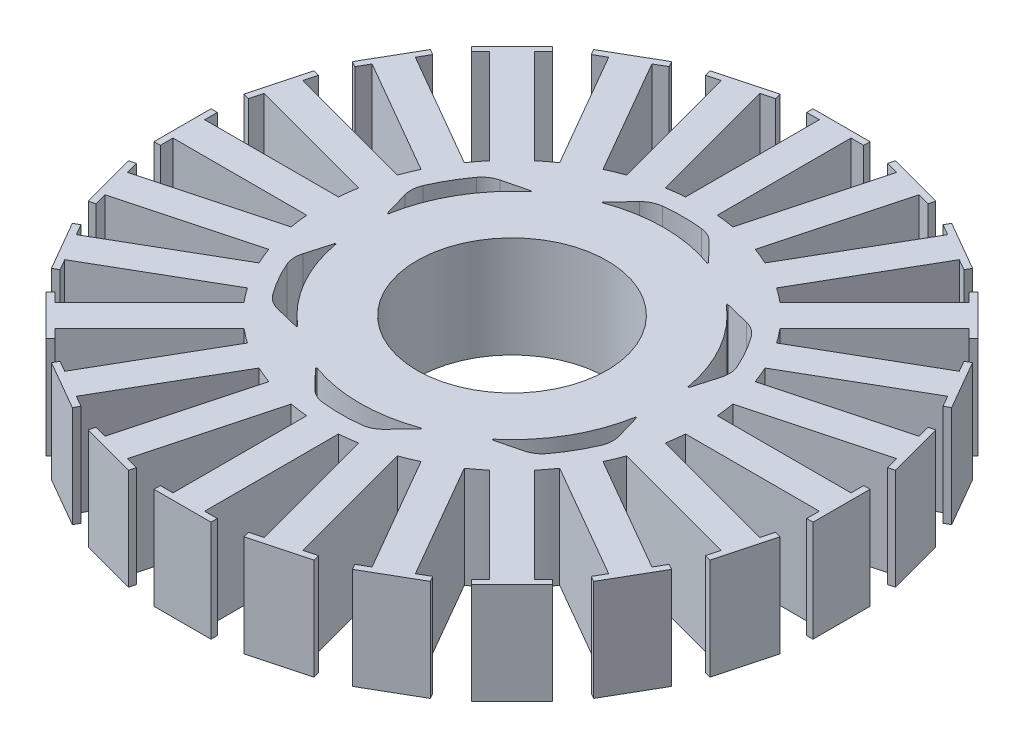
from build123d import *

# Parameters (mm, degrees)
SKETCH3_R           = 7.5
BOSS_EXTRUDE1_DEPTH = 8
CUT_EXTRUDE1_DEPTH  = 8


with BuildPart() as part:
    # Sketch3 → Boss-Extrude1 (new body)
    with BuildSketch(Plane(origin=(0, 0, 0), x_dir=(1, 0, 0), z_dir=(0, 1, 0))):
        with BuildLine():
            Line((-1.25, 25.5), (-1.25, 14.947825929))
            ThreePointArc((-1.25, 14.947825929), (-1.957892883, 14.871672921), (-2.66137475, 14.762014918))
            Line((-2.66137475, 14.762014918), (-5.392478367, 24.954632377))
            Line((-5.392478367, 24.954632377), (-4.426552541, 25.213451422))
            Line((-4.426552541, 25.213451422), (-4.555962064, 25.696414335))
            Line((-4.555962064, 25.696414335), (-8.902628282, 24.531728632))
            Line((-8.902628282, 24.531728632), (-8.773218759, 24.048765719))
            Line((-8.773218759, 24.048765719), (-7.807292933, 24.307584764))
            Line((-7.807292933, 24.307584764), (-5.076189316, 14.114967305))
            ThreePointArc((-5.076189316, 14.114967305), (-5.740251485, 13.858192988), (-6.39138121, 13.570196986))
            Line((-6.39138121, 13.570196986), (-11.667468245, 22.708647797))
            Line((-11.667468245, 22.708647797), (-10.801442841, 23.208647797))
            Line((-10.801442841, 23.208647797), (-11.051442841, 23.641660498))
            Line((-11.051442841, 23.641660498), (-14.948557159, 21.391660498))
            Line((-14.948557159, 21.391660498), (-14.698557159, 20.958647797))
            Line((-14.698557159, 20.958647797), (-13.832531755, 21.458647797))
            Line((-13.832531755, 21.458647797), (-8.556444719, 12.320196986))
            ThreePointArc((-8.556444719, 12.320196986), (-9.131421435, 11.900300104), (-9.685825602, 11.453592555))
            Line((-9.685825602, 11.453592555), (-17.147339444, 18.915106397))
            Line((-17.147339444, 18.915106397), (-16.440232663, 19.622213178))
            Line((-16.440232663, 19.622213178), (-16.793786053, 19.975766569))
            Line((-16.793786053, 19.975766569), (-19.975766569, 16.793786053))
            Line((-19.975766569, 16.793786053), (-19.622213178, 16.440232663))
            Line((-19.622213178, 16.440232663), (-18.915106397, 17.147339444))
            Line((-18.915106397, 17.147339444), (-11.453592555, 9.685825602))
            ThreePointArc((-11.453592555, 9.685825602), (-11.900300104, 9.131421435), (-12.320196986, 8.556444719))
            Line((-12.320196986, 8.556444719), (-21.458647797, 13.832531755))
            Line((-21.458647797, 13.832531755), (-20.958647797, 14.698557159))
            Line((-20.958647797, 14.698557159), (-21.391660498, 14.948557159))
            Line((-21.391660498, 14.948557159), (-23.641660498, 11.051442841))
            Line((-23.641660498, 11.051442841), (-23.208647797, 10.801442841))
            Line((-23.208647797, 10.801442841), (-22.708647797, 11.667468245))
            Line((-22.708647797, 11.667468245), (-13.570196986, 6.39138121))
            ThreePointArc((-13.570196986, 6.39138121), (-13.858192988, 5.740251485), (-14.114967305, 5.076189316))
            Line((-14.114967305, 5.076189316), (-24.307584764, 7.807292933))
            Line((-24.307584764, 7.807292933), (-24.048765719, 8.773218759))
            Line((-24.048765719, 8.773218759), (-24.531728632, 8.902628282))
            Line((-24.531728632, 8.902628282), (-25.696414335, 4.555962064))
            Line((-25.696414335, 4.555962064), (-25.213451422, 4.426552541))
            Line((-25.213451422, 4.426552541), (-24.954632377, 5.392478367))
            Line((-24.954632377, 5.392478367), (-14.762014918, 2.66137475))
            ThreePointArc((-14.762014918, 2.66137475), (-14.871672921, 1.957892883), (-14.947825929, 1.25))
            Line((-14.947825929, 1.25), (-25.5, 1.25))
            Line((-25.5, 1.25), (-25.5, 2.25))
            Line((-25.5, 2.25), (-26, 2.25))
            Line((-26, 2.25), (-26, -2.25))
            Line((-26, -2.25), (-25.5, -2.25))
            Line((-25.5, -2.25), (-25.5, -1.25))
            Line((-25.5, -1.25), (-14.947825929, -1.25))
            ThreePointArc((-14.947825929, -1.25), (-14.871672921, -1.957892883), (-14.762014918, -2.66137475))
            Line((-14.762014918, -2.66137475), (-24.954632377, -5.392478367))
            Line((-24.954632377, -5.392478367), (-25.213451422, -4.426552541))
            Line((-25.213451422, -4.426552541), (-25.696414335, -4.555962064))
            Line((-25.696414335, -4.555962064), (-24.531728632, -8.902628282))
            Line((-24.531728632, -8.902628282), (-24.048765719, -8.773218759))
            Line((-24.048765719, -8.773218759), (-24.307584764, -7.807292933))
            Line((-24.307584764, -7.807292933), (-14.114967305, -5.076189316))
            ThreePointArc((-14.114967305, -5.076189316), (-13.858192988, -5.740251485), (-13.570196986, -6.39138121))
            Line((-13.570196986, -6.39138121), (-22.708647797, -11.667468245))
            Line((-22.708647797, -11.667468245), (-23.208647797, -10.801442841))
            Line((-23.208647797, -10.801442841), (-23.641660498, -11.051442841))
            Line((-23.641660498, -11.051442841), (-21.391660498, -14.948557159))
            Line((-21.391660498, -14.948557159), (-20.958647797, -14.698557159))
            Line((-20.958647797, -14.698557159), (-21.458647797, -13.832531755))
            Line((-21.458647797, -13.832531755), (-12.320196986, -8.556444719))
            ThreePointArc((-12.320196986, -8.556444719), (-11.900300104, -9.131421435), (-11.453592555, -9.685825602))
            Line((-11.453592555, -9.685825602), (-18.915106397, -17.147339444))
            Line((-18.915106397, -17.147339444), (-19.622213178, -16.440232663))
            Line((-19.622213178, -16.440232663), (-19.975766569, -16.793786053))
            Line((-19.975766569, -16.793786053), (-16.793786053, -19.975766569))
            Line((-16.793786053, -19.975766569), (-16.440232663, -19.622213178))
            Line((-16.440232663, -19.622213178), (-17.147339444, -18.915106397))
            Line((-17.147339444, -18.915106397), (-9.685825602, -11.453592555))
            ThreePointArc((-9.685825602, -11.453592555), (-9.131421435, -11.900300104), (-8.556444719, -12.320196986))
            Line((-8.556444719, -12.320196986), (-13.832531755, -21.458647797))
            Line((-13.832531755, -21.458647797), (-14.698557159, -20.958647797))
            Line((-14.698557159, -20.958647797), (-14.948557159, -21.391660498))
            Line((-14.948557159, -21.391660498), (-11.051442841, -23.641660498))
            Line((-11.051442841, -23.641660498), (-10.801442841, -23.208647797))
            Line((-10.801442841, -23.208647797), (-11.667468245, -22.708647797))
            Line((-11.667468245, -22.708647797), (-6.39138121, -13.570196986))
            ThreePointArc((-6.39138121, -13.570196986), (-5.740251485, -13.858192988), (-5.076189316, -14.114967305))
            Line((-5.076189316, -14.114967305), (-7.807292933, -24.307584764))
            Line((-7.807292933, -24.307584764), (-8.773218759, -24.048765719))
            Line((-8.773218759, -24.048765719), (-8.902628282, -24.531728632))
            Line((-8.902628282, -24.531728632), (-4.555962064, -25.696414335))
            Line((-4.555962064, -25.696414335), (-4.426552541, -25.213451422))
            Line((-4.426552541, -25.213451422), (-5.392478367, -24.954632377))
            Line((-5.392478367, -24.954632377), (-2.66137475, -14.762014918))
            ThreePointArc((-2.66137475, -14.762014918), (-1.957892883, -14.871672921), (-1.25, -14.947825929))
            Line((-1.25, -14.947825929), (-1.25, -25.5))
            Line((-1.25, -25.5), (-2.25, -25.5))
            Line((-2.25, -25.5), (-2.25, -26))
            Line((-2.25, -26), (2.25, -26))
            Line((2.25, -26), (2.25, -25.5))
            Line((2.25, -25.5), (1.25, -25.5))
            Line((1.25, -25.5), (1.25, -14.947825929))
            ThreePointArc((1.25, -14.947825929), (1.957892883, -14.871672921), (2.66137475, -14.762014918))
            Line((2.66137475, -14.762014918), (5.392478367, -24.954632377))
            Line((5.392478367, -24.954632377), (4.426552541, -25.213451422))
            Line((4.426552541, -25.213451422), (4.555962064, -25.696414335))
            Line((4.555962064, -25.696414335), (8.902628282, -24.531728632))
            Line((8.902628282, -24.531728632), (8.773218759, -24.048765719))
            Line((8.773218759, -24.048765719), (7.807292933, -24.307584764))
            Line((7.807292933, -24.307584764), (5.076189316, -14.114967305))
            ThreePointArc((5.076189316, -14.114967305), (5.740251485, -13.858192988), (6.39138121, -13.570196986))
            Line((6.39138121, -13.570196986), (11.667468245, -22.708647797))
            Line((11.667468245, -22.708647797), (10.801442841, -23.208647797))
            Line((10.801442841, -23.208647797), (11.051442841, -23.641660498))
            Line((11.051442841, -23.641660498), (14.948557159, -21.391660498))
            Line((14.948557159, -21.391660498), (14.698557159, -20.958647797))
            Line((14.698557159, -20.958647797), (13.832531755, -21.458647797))
            Line((13.832531755, -21.458647797), (8.556444719, -12.320196986))
            ThreePointArc((8.556444719, -12.320196986), (9.131421435, -11.900300104), (9.685825602, -11.453592555))
            Line((9.685825602, -11.453592555), (17.147339444, -18.915106397))
            Line((17.147339444, -18.915106397), (16.440232663, -19.622213178))
            Line((16.440232663, -19.622213178), (16.793786053, -19.975766569))
            Line((16.793786053, -19.975766569), (19.975766569, -16.793786053))
            Line((19.975766569, -16.793786053), (19.622213178, -16.440232663))
            Line((19.622213178, -16.440232663), (18.915106397, -17.147339444))
            Line((18.915106397, -17.147339444), (11.453592555, -9.685825602))
            ThreePointArc((11.453592555, -9.685825602), (11.900300104, -9.131421435), (12.320196986, -8.556444719))
            Line((12.320196986, -8.556444719), (21.458647797, -13.832531755))
            Line((21.458647797, -13.832531755), (20.958647797, -14.698557159))
            Line((20.958647797, -14.698557159), (21.391660498, -14.948557159))
            Line((21.391660498, -14.948557159), (23.641660498, -11.051442841))
            Line((23.641660498, -11.051442841), (23.208647797, -10.801442841))
            Line((23.208647797, -10.801442841), (22.708647797, -11.667468245))
            Line((22.708647797, -11.667468245), (13.570196986, -6.39138121))
            ThreePointArc((13.570196986, -6.39138121), (13.858192988, -5.740251485), (14.114967305, -5.076189316))
            Line((14.114967305, -5.076189316), (24.307584764, -7.807292933))
            Line((24.307584764, -7.807292933), (24.048765719, -8.773218759))
            Line((24.048765719, -8.773218759), (24.531728632, -8.902628282))
            Line((24.531728632, -8.902628282), (25.696414335, -4.555962064))
            Line((25.696414335, -4.555962064), (25.213451422, -4.426552541))
            Line((25.213451422, -4.426552541), (24.954632377, -5.392478367))
            Line((24.954632377, -5.392478367), (14.762014918, -2.66137475))
            ThreePointArc((14.762014918, -2.66137475), (14.871672921, -1.957892883), (14.947825929, -1.25))
            Line((14.947825929, -1.25), (25.5, -1.25))
            Line((25.5, -1.25), (25.5, -2.25))
            Line((25.5, -2.25), (26, -2.25))
            Line((26, -2.25), (26, 2.25))
            Line((26, 2.25), (25.5, 2.25))
            Line((25.5, 2.25), (25.5, 1.25))
            Line((25.5, 1.25), (14.947825929, 1.25))
            ThreePointArc((14.947825929, 1.25), (14.871672921, 1.957892883), (14.762014918, 2.66137475))
            Line((14.762014918, 2.66137475), (24.954632377, 5.392478367))
            Line((24.954632377, 5.392478367), (25.213451422, 4.426552541))
            Line((25.213451422, 4.426552541), (25.696414335, 4.555962064))
            Line((25.696414335, 4.555962064), (24.531728632, 8.902628282))
            Line((24.531728632, 8.902628282), (24.048765719, 8.773218759))
            Line((24.048765719, 8.773218759), (24.307584764, 7.807292933))
            Line((24.307584764, 7.807292933), (14.114967305, 5.076189316))
            ThreePointArc((14.114967305, 5.076189316), (13.858192988, 5.740251485), (13.570196986, 6.39138121))
            Line((13.570196986, 6.39138121), (22.708647797, 11.667468245))
            Line((22.708647797, 11.667468245), (23.208647797, 10.801442841))
            Line((23.208647797, 10.801442841), (23.641660498, 11.051442841))
            Line((23.641660498, 11.051442841), (21.391660498, 14.948557159))
            Line((21.391660498, 14.948557159), (20.958647797, 14.698557159))
            Line((20.958647797, 14.698557159), (21.458647797, 13.832531755))
            Line((21.458647797, 13.832531755), (12.320196986, 8.556444719))
            ThreePointArc((12.320196986, 8.556444719), (11.900300104, 9.131421435), (11.453592555, 9.685825602))
            Line((11.453592555, 9.685825602), (18.915106397, 17.147339444))
            Line((18.915106397, 17.147339444), (19.622213178, 16.440232663))
            Line((19.622213178, 16.440232663), (19.975766569, 16.793786053))
            Line((19.975766569, 16.793786053), (16.793786053, 19.975766569))
            Line((16.793786053, 19.975766569), (16.440232663, 19.622213178))
            Line((16.440232663, 19.622213178), (17.147339444, 18.915106397))
            Line((17.147339444, 18.915106397), (9.685825602, 11.453592555))
            ThreePointArc((9.685825602, 11.453592555), (9.131421435, 11.900300104), (8.556444719, 12.320196986))
            Line((8.556444719, 12.320196986), (13.832531755, 21.458647797))
            Line((13.832531755, 21.458647797), (14.698557159, 20.958647797))
            Line((14.698557159, 20.958647797), (14.948557159, 21.391660498))
            Line((14.948557159, 21.391660498), (11.051442841, 23.641660498))
            Line((11.051442841, 23.641660498), (10.801442841, 23.208647797))
            Line((10.801442841, 23.208647797), (11.667468245, 22.708647797))
            Line((11.667468245, 22.708647797), (6.39138121, 13.570196986))
            ThreePointArc((6.39138121, 13.570196986), (5.740251485, 13.858192988), (5.076189316, 14.114967305))
            Line((5.076189316, 14.114967305), (7.807292933, 24.307584764))
            Line((7.807292933, 24.307584764), (8.773218759, 24.048765719))
            Line((8.773218759, 24.048765719), (8.902628282, 24.531728632))
            Line((8.902628282, 24.531728632), (4.555962064, 25.696414335))
            Line((4.555962064, 25.696414335), (4.426552541, 25.213451422))
            Line((4.426552541, 25.213451422), (5.392478367, 24.954632377))
            Line((5.392478367, 24.954632377), (2.66137475, 14.762014918))
            ThreePointArc((2.66137475, 14.762014918), (1.957892883, 14.871672921), (1.25, 14.947825929))
            Line((1.25, 14.947825929), (1.25, 25.5))
            Line((1.25, 25.5), (2.25, 25.5))
            Line((2.25, 25.5), (2.25, 26))
            Line((2.25, 26), (-2.25, 26))
            Line((-2.25, 26), (-2.25, 25.5))
            Line((-2.25, 25.5), (-1.25, 25.5))
        make_face()
        with Locations(Location((0, 0, 0), (0, 0, 270))):
            Circle(SKETCH3_R, mode=Mode.SUBTRACT)
    extrude(amount=BOSS_EXTRUDE1_DEPTH)

    # Sketch4 → Cut-Extrude1 (cut)
    with BuildSketch(Plane(origin=(0, 8, 0), x_dir=(1, 0, 0), z_dir=(0, 1, 0))):
        with BuildLine():
            Line((2.748130317, 12.812591853), (4.143894554, 11.362867428))
            ThreePointArc((4.143894554, 11.362867428), (4.14980442, 11.300950147), (4.090830107, 11.281183849))
            ThreePointArc((4.090830107, 11.281183849), (0, 12), (-4.090830107, 11.281183849))
            ThreePointArc((-4.090830107, 11.281183849), (-4.14980442, 11.300950147), (-4.143894554, 11.362867428))
            Line((-4.143894554, 11.362867428), (-2.748130317, 12.812591853))
            ThreePointArc((-2.748130317, 12.812591853), (-2.193720098, 13.218309997), (-1.534723985, 13.412480095))
            ThreePointArc((-1.534723985, 13.412480095), (0, 13.5), (1.534723985, 13.412480095))
            ThreePointArc((1.534723985, 13.412480095), (2.193720098, 13.218309997), (2.748130317, 12.812591853))
        make_face()
        with BuildLine():
            Line((9.721964875, 8.786246594), (7.768584576, 9.270151668))
            ThreePointArc((7.768584576, 9.270151668), (7.712007704, 9.244311122), (7.724376744, 9.18335472))
            ThreePointArc((7.724376744, 9.18335472), (10.392304845, 6), (11.815206852, 2.097829129))
            ThreePointArc((11.815206852, 2.097829129), (11.861812125, 2.056639025), (11.912479129, 2.09271576))
            Line((11.912479129, 2.09271576), (12.470095192, 4.026345259))
            ThreePointArc((12.470095192, 4.026345259), (12.544252302, 4.709337665), (12.382910482, 5.377130089))
            ThreePointArc((12.382910482, 5.377130089), (11.691342951, 6.75), (10.848186497, 8.035350006))
            ThreePointArc((10.848186497, 8.035350006), (10.350532204, 8.508972332), (9.721964875, 8.786246594))
        make_face()
        with BuildLine():
            Line((12.470095192, -4.026345259), (11.912479129, -2.09271576))
            ThreePointArc((11.912479129, -2.09271576), (11.861812125, -2.056639025), (11.815206852, -2.097829129))
            ThreePointArc((11.815206852, -2.097829129), (10.392304845, -6), (7.724376744, -9.18335472))
            ThreePointArc((7.724376744, -9.18335472), (7.712007704, -9.244311122), (7.768584576, -9.270151668))
            Line((7.768584576, -9.270151668), (9.721964875, -8.786246594))
            ThreePointArc((9.721964875, -8.786246594), (10.350532204, -8.508972332), (10.848186497, -8.035350006))
            ThreePointArc((10.848186497, -8.035350006), (11.691342951, -6.75), (12.382910482, -5.377130089))
            ThreePointArc((12.382910482, -5.377130089), (12.544252302, -4.709337665), (12.470095192, -4.026345259))
        make_face()
        with BuildLine():
            Line((2.748130317, -12.812591853), (4.143894554, -11.362867428))
            ThreePointArc((4.143894554, -11.362867428), (4.14980442, -11.300950147), (4.090830107, -11.281183849))
            ThreePointArc((4.090830107, -11.281183849), (0, -12), (-4.090830107, -11.281183849))
            ThreePointArc((-4.090830107, -11.281183849), (-4.14980442, -11.300950147), (-4.143894554, -11.362867428))
            Line((-4.143894554, -11.362867428), (-2.748130317, -12.812591853))
            ThreePointArc((-2.748130317, -12.812591853), (-2.193720098, -13.218309997), (-1.534723985, -13.412480095))
            ThreePointArc((-1.534723985, -13.412480095), (0, -13.5), (1.534723985, -13.412480095))
            ThreePointArc((1.534723985, -13.412480095), (2.193720098, -13.218309997), (2.748130317, -12.812591853))
        make_face()
        with BuildLine():
            Line((-9.721964875, -8.786246594), (-7.768584576, -9.270151668))
            ThreePointArc((-7.768584576, -9.270151668), (-7.712007704, -9.244311122), (-7.724376744, -9.18335472))
            ThreePointArc((-7.724376744, -9.18335472), (-10.392304845, -6), (-11.815206852, -2.097829129))
            ThreePointArc((-11.815206852, -2.097829129), (-11.861812125, -2.056639025), (-11.912479129, -2.09271576))
            Line((-11.912479129, -2.09271576), (-12.470095192, -4.026345259))
            ThreePointArc((-12.470095192, -4.026345259), (-12.544252302, -4.709337665), (-12.382910482, -5.377130089))
            ThreePointArc((-12.382910482, -5.377130089), (-11.691342951, -6.75), (-10.848186497, -8.035350006))
            ThreePointArc((-10.848186497, -8.035350006), (-10.350532204, -8.508972332), (-9.721964875, -8.786246594))
        make_face()
        with BuildLine():
            Line((-12.470095192, 4.026345259), (-11.912479129, 2.09271576))
            ThreePointArc((-11.912479129, 2.09271576), (-11.861812125, 2.056639025), (-11.815206852, 2.097829129))
            ThreePointArc((-11.815206852, 2.097829129), (-10.392304845, 6), (-7.724376744, 9.18335472))
            ThreePointArc((-7.724376744, 9.18335472), (-7.712007704, 9.244311122), (-7.768584576, 9.270151668))
            Line((-7.768584576, 9.270151668), (-9.721964875, 8.786246594))
            ThreePointArc((-9.721964875, 8.786246594), (-10.350532204, 8.508972332), (-10.848186497, 8.035350006))
            ThreePointArc((-10.848186497, 8.035350006), (-11.691342951, 6.75), (-12.382910482, 5.377130089))
            ThreePointArc((-12.382910482, 5.377130089), (-12.544252302, 4.709337665), (-12.470095192, 4.026345259))
        make_face()
    extrude(amount=-CUT_EXTRUDE1_DEPTH, mode=Mode.SUBTRACT)


solid = part.part
